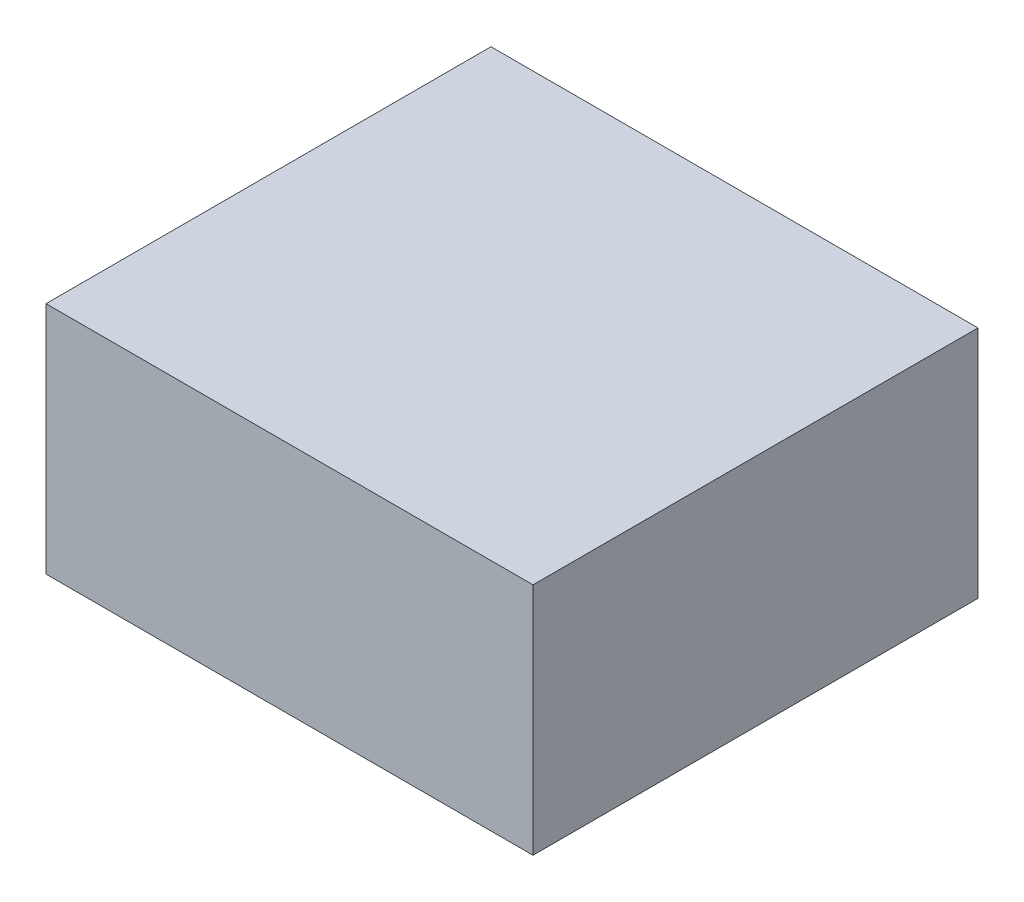
from build123d import *

# Parameters (mm, degrees)
SKETCH1_W           = 60.3
SKETCH1_H           = 55.1
BOSS_EXTRUDE1_DEPTH = 29


with BuildPart() as part:
    # Sketch1 → Boss-Extrude1 (new body)
    with BuildSketch(Plane(origin=(0, 0, 0), x_dir=(1, 0, 0), z_dir=(0, 1, 0))):
        with Locations((30.15, -27.55)):
            Rectangle(SKETCH1_W, SKETCH1_H)
    extrude(amount=BOSS_EXTRUDE1_DEPTH)


solid = part.part
